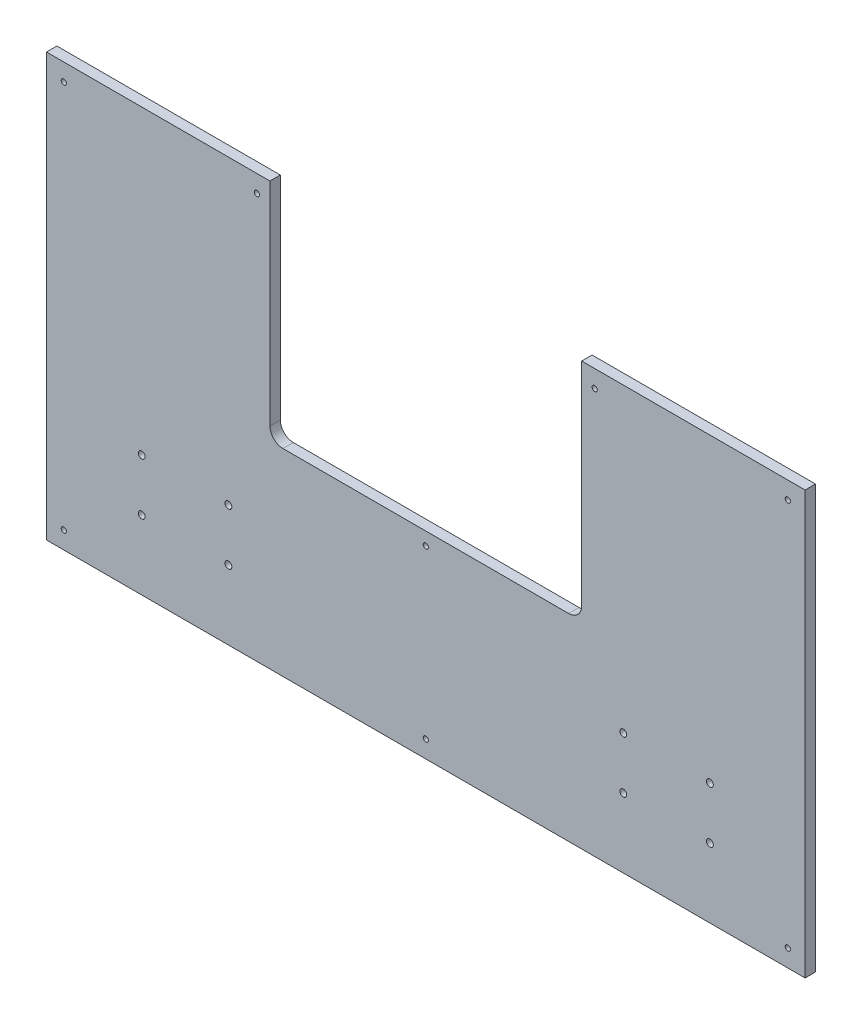
from build123d import *

# Parameters (mm, degrees)
SKETCH_1_R      = 1.5
SKETCH_1_R_2    = 2
EXTRUDE_1_DEPTH = 6


with BuildPart() as part:
    # Эскиз1 → Бобышка-Вытянуть1 (new body)
    with BuildSketch(Plane.XY):
        with BuildLine():
            Line((129, 244), (129, 121.5))
            ThreePointArc((129, 121.5), (131.196699141, 116.196699141), (136.5, 114))
            Line((136.5, 114), (301.5, 114))
            ThreePointArc((301.5, 114), (306.803300859, 116.196699141), (309, 121.5))
            Line((309, 121.5), (309, 244))
            Line((309, 244), (438, 244))
            Line((438, 244), (438, 0))
            Line((438, 0), (0, 0))
            Line((0, 0), (0, 244))
            Line((0, 244), (129, 244))
        make_face()
        with Locations((10, 10)):
            Circle(SKETCH_1_R, mode=Mode.SUBTRACT)
        with Locations((10, 234)):
            Circle(SKETCH_1_R, mode=Mode.SUBTRACT)
        with Locations((121.5, 234)):
            Circle(SKETCH_1_R, mode=Mode.SUBTRACT)
        with Locations((316.5, 234)):
            Circle(SKETCH_1_R, mode=Mode.SUBTRACT)
        with Locations((428, 234)):
            Circle(SKETCH_1_R, mode=Mode.SUBTRACT)
        with Locations((428, 10)):
            Circle(SKETCH_1_R, mode=Mode.SUBTRACT)
        with Locations((219, 106.5)):
            Circle(SKETCH_1_R, mode=Mode.SUBTRACT)
        with Locations((219, 10)):
            Circle(SKETCH_1_R, mode=Mode.SUBTRACT)
        with Locations((333, 70)):
            Circle(SKETCH_1_R_2, mode=Mode.SUBTRACT)
        with Locations((383, 70)):
            Circle(SKETCH_1_R_2, mode=Mode.SUBTRACT)
        with Locations((383, 40)):
            Circle(SKETCH_1_R_2, mode=Mode.SUBTRACT)
        with Locations((333, 40)):
            Circle(SKETCH_1_R_2, mode=Mode.SUBTRACT)
        with Locations((55, 70)):
            Circle(SKETCH_1_R_2, mode=Mode.SUBTRACT)
        with Locations((105, 70)):
            Circle(SKETCH_1_R_2, mode=Mode.SUBTRACT)
        with Locations((55, 40)):
            Circle(SKETCH_1_R_2, mode=Mode.SUBTRACT)
        with Locations((105, 40)):
            Circle(SKETCH_1_R_2, mode=Mode.SUBTRACT)
    extrude(amount=EXTRUDE_1_DEPTH)


solid = part.part
